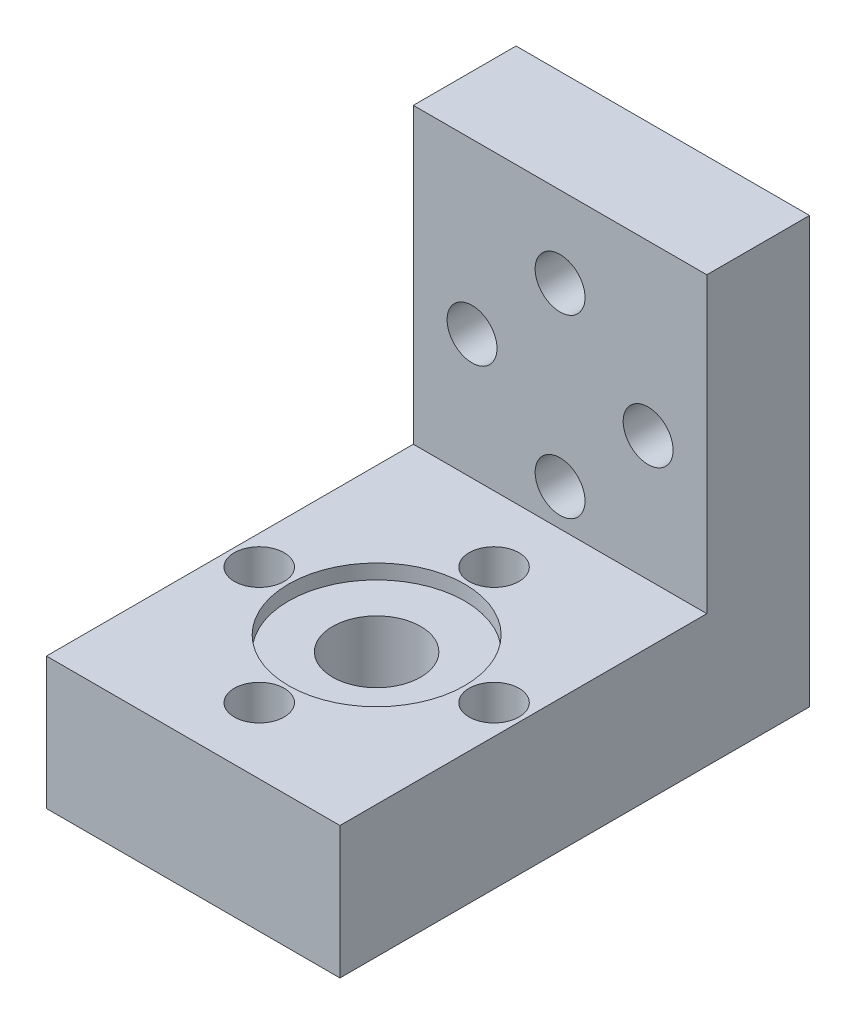
from build123d import *

# Parameters (mm, degrees)
BOSS_EXTRUDE2_DEPTH = 40
SKETCH4_R           = 12
CUT_EXTRUDE4_DEPTH  = 2
SKETCH5_R           = 6
CUT_EXTRUDE5_DEPTH  = 77.576758876
SKETCH6_R           = 3.4
CUT_EXTRUDE6_DEPTH  = 76.498344353
SKETCH7_R           = 3.4
CUT_EXTRUDE7_DEPTH  = 87.394444266


with BuildPart() as part:
    # Sketch1 → Boss-Extrude2 (new body)
    with BuildSketch(Plane(origin=(0, 0, 0), x_dir=(0, 0, -1), z_dir=(1, 0, 0))):
        Polygon((0, 0), (-50, 0), (-50, 18), (0, 18), (0, 58), (14, 58), (14, 0), align=None)
    extrude(amount=BOSS_EXTRUDE2_DEPTH)

    # Sketch4 → Cut-Extrude4 (cut)
    with BuildSketch(Plane(origin=(0, 18, 0), x_dir=(1, 0, 0), z_dir=(0, 1, 0))):
        with Locations(Location((20, -25, 0), (0, 0, 270))):
            Circle(SKETCH4_R)
    extrude(amount=-CUT_EXTRUDE4_DEPTH, mode=Mode.SUBTRACT)

    # Sketch5 → Cut-Extrude5 (cut, through all)
    with BuildSketch(Plane(origin=(0, 16, 0), x_dir=(1, 0, 0), z_dir=(0, 1, 0))):
        with Locations(Location((20, -25, 0), (0, 0, 270))):
            Circle(SKETCH5_R)
    extrude(amount=-CUT_EXTRUDE5_DEPTH, mode=Mode.SUBTRACT)

    # Sketch6 → Cut-Extrude6 (cut, through all)
    with BuildSketch(Plane(origin=(0, 18, 0), x_dir=(1, 0, 0), z_dir=(0, 1, 0))):
        with Locations(Location((20, -9, 0), (0, 0, 270))):
            Circle(SKETCH6_R)
        with Locations(Location((36, -25, 0), (0, 0, 270))):
            Circle(SKETCH6_R)
        with Locations(Location((20, -41, 0), (0, 0, 270))):
            Circle(SKETCH6_R)
        with Locations(Location((4, -25, 0), (0, 0, 270))):
            Circle(SKETCH6_R)
    extrude(amount=-CUT_EXTRUDE6_DEPTH, mode=Mode.SUBTRACT)

    # Sketch7 → Cut-Extrude7 (cut, through all)
    with BuildSketch(Plane.XY):
        with Locations((20, 47)):
            Circle(SKETCH7_R)
        with Locations((32, 35)):
            Circle(SKETCH7_R)
        with Locations((20, 23)):
            Circle(SKETCH7_R)
        with Locations((8, 35)):
            Circle(SKETCH7_R)
    extrude(amount=-CUT_EXTRUDE7_DEPTH, mode=Mode.SUBTRACT)


solid = part.part
